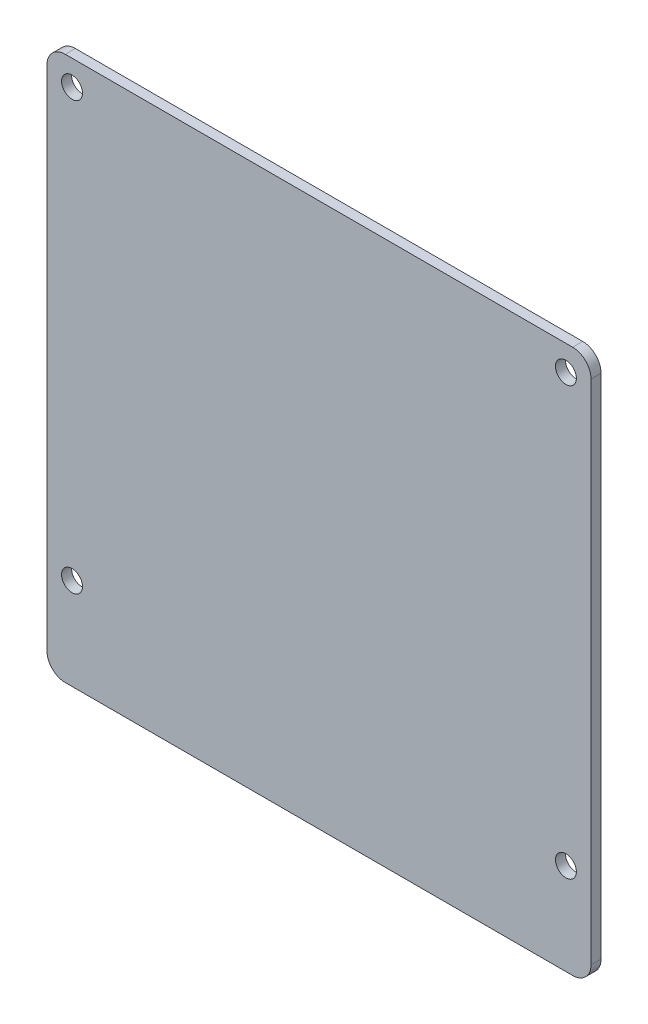
from build123d import *

# Parameters (mm, degrees)
SKETCH3_R           = 1.25
BOSS_EXTRUDE1_DEPTH = 1.2


with BuildPart() as part:
    # Sketch3 → Boss-Extrude1 (new body)
    with BuildSketch(Plane.XY):
        with BuildLine():
            Line((-30.3, 32.5), (30.3, 32.5))
            ThreePointArc((30.3, 32.5), (31.855634919, 31.855634919), (32.5, 30.3))
            Line((32.5, 30.3), (32.5, -30.3))
            ThreePointArc((32.5, -30.3), (31.855634919, -31.855634919), (30.3, -32.5))
            Line((30.3, -32.5), (-30.3, -32.5))
            ThreePointArc((-30.3, -32.5), (-31.855634919, -31.855634919), (-32.5, -30.3))
            Line((-32.5, -30.3), (-32.5, 30.3))
            ThreePointArc((-32.5, 30.3), (-31.855634919, 31.855634919), (-30.3, 32.5))
        make_face()
        with Locations((-29.5, 29.5)):
            Circle(SKETCH3_R, mode=Mode.SUBTRACT)
        with Locations((-29.5, -21.55)):
            Circle(SKETCH3_R, mode=Mode.SUBTRACT)
        with Locations((29.5, -21.55)):
            Circle(SKETCH3_R, mode=Mode.SUBTRACT)
        with Locations((29.5, 29.5)):
            Circle(SKETCH3_R, mode=Mode.SUBTRACT)
    extrude(amount=BOSS_EXTRUDE1_DEPTH)


solid = part.part
